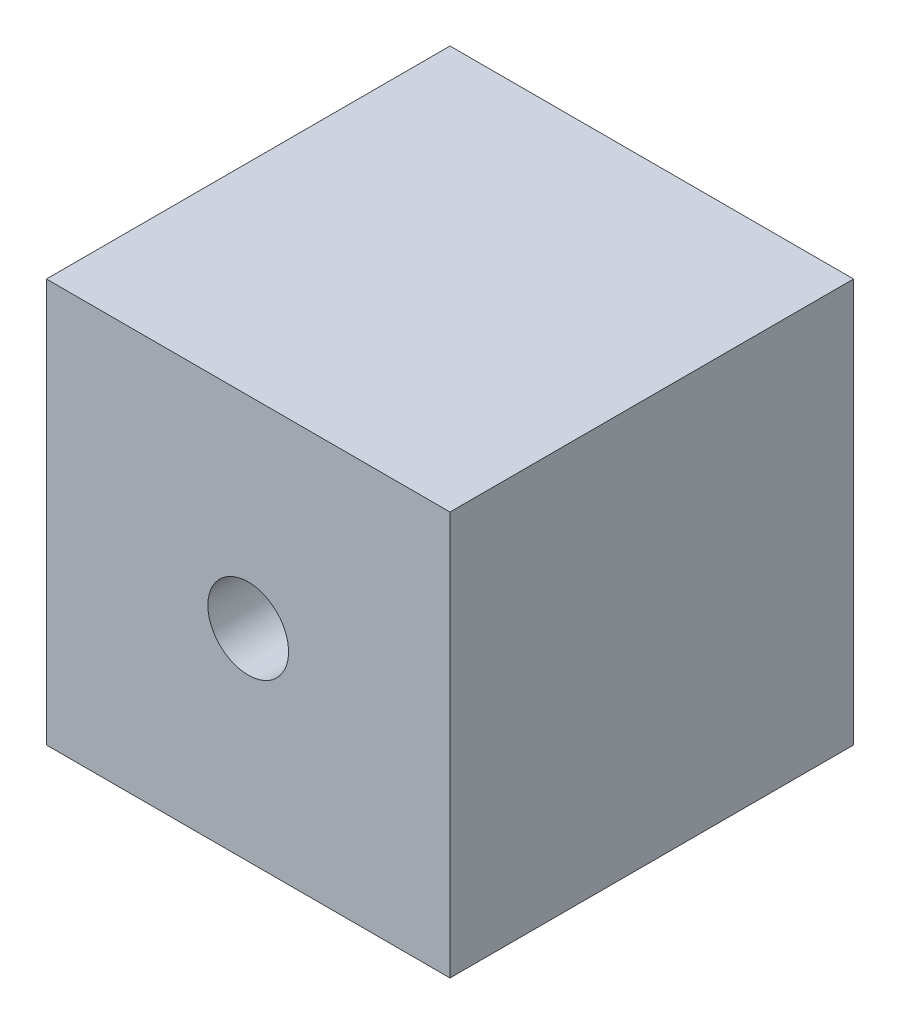
from build123d import *

# Parameters (mm, degrees)
TEST_BOX_START     = -10
TEST_BOX_PROFILE_W = 20
TEST_BOX_PROFILE_H = 20
TEST_BOX_DEPTH     = 20
TEST_CUT_START     = -12
TEST_CUT_PROFILE_R = 2
TEST_CUT_DEPTH     = 24


with BuildPart() as part:
    # Test_box_Profile → Test_box (new body)
    with BuildSketch(Plane.XY.offset(TEST_BOX_START)):
        Rectangle(TEST_BOX_PROFILE_W, TEST_BOX_PROFILE_H)
    extrude(amount=TEST_BOX_DEPTH)

    # Test_cut_Profile → Test_cut (cut)
    with BuildSketch(Plane.XY.offset(TEST_CUT_START)):
        with Locations(Location((0, 0, 0), (0, 0, 180))):
            Circle(TEST_CUT_PROFILE_R)
    extrude(amount=TEST_CUT_DEPTH, mode=Mode.SUBTRACT)


solid = part.part
